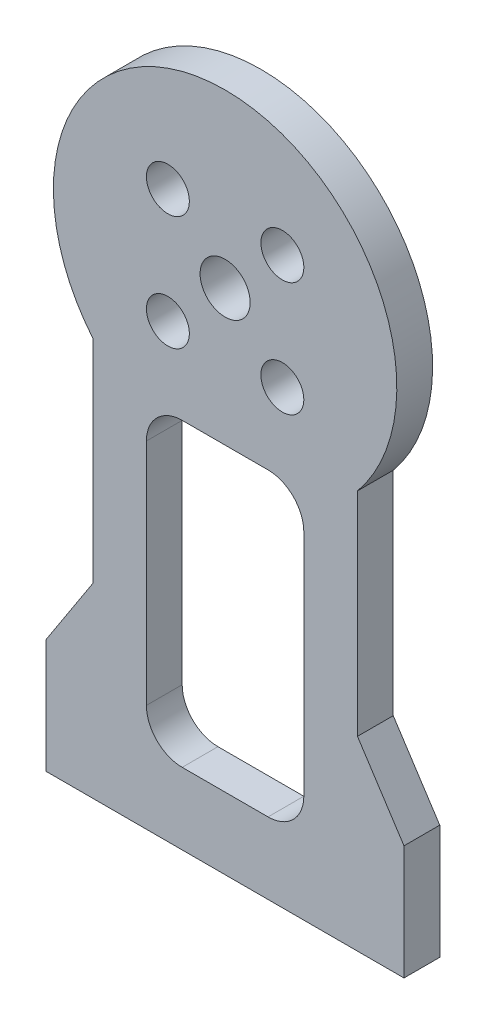
from build123d import *

# Parameters (mm, degrees)
SZKIC1_R                    = 1.75
SZKIC1_R_2                  = 1.5
DODANIE_WYCI_GNI_CIE1_DEPTH = 2.5


with BuildPart() as part:
    # Szkic1 → Dodanie-wyciągnięcie1 (new body)
    with BuildSketch(Plane.XY):
        with BuildLine():
            Line((12.5, 0), (-12.5, 0))
            Line((-12.5, 0), (-12.5, 8))
            Line((-12.5, 8), (-9.25, 13))
            Line((-9.25, 13), (-9.25, 27.855557574))
            ThreePointArc((-9.25, 27.855557574), (0, 47.5), (9.25, 27.855557574))
            Line((9.25, 27.855557574), (9.25, 13))
            Line((9.25, 13), (12.5, 8))
            Line((12.5, 8), (12.5, 0))
        make_face()
        with Locations((0, 35.5)):
            Circle(SZKIC1_R, mode=Mode.SUBTRACT)
        with Locations((-4, 39.5)):
            Circle(SZKIC1_R_2, mode=Mode.SUBTRACT)
        with Locations(Location((-4, 31.5, 0), (0, 0, 180))):
            Circle(SZKIC1_R_2, mode=Mode.SUBTRACT)
        with Locations((4, 31.5)):
            Circle(SZKIC1_R_2, mode=Mode.SUBTRACT)
        with Locations(Location((4, 39.5, 0), (0, 0, 180))):
            Circle(SZKIC1_R_2, mode=Mode.SUBTRACT)
        with BuildLine():
            Line((3, 5), (-3, 5))
            ThreePointArc((-3, 5), (-4.767766953, 5.732233047), (-5.5, 7.5))
            Line((-5.5, 7.5), (-5.5, 23.5))
            ThreePointArc((-5.5, 23.5), (-4.767766953, 25.267766953), (-3, 26))
            Line((-3, 26), (3, 26))
            ThreePointArc((3, 26), (4.767766953, 25.267766953), (5.5, 23.5))
            Line((5.5, 23.5), (5.5, 7.5))
            ThreePointArc((5.5, 7.5), (4.767766953, 5.732233047), (3, 5))
        make_face(mode=Mode.SUBTRACT)
    extrude(amount=DODANIE_WYCI_GNI_CIE1_DEPTH)


solid = part.part
